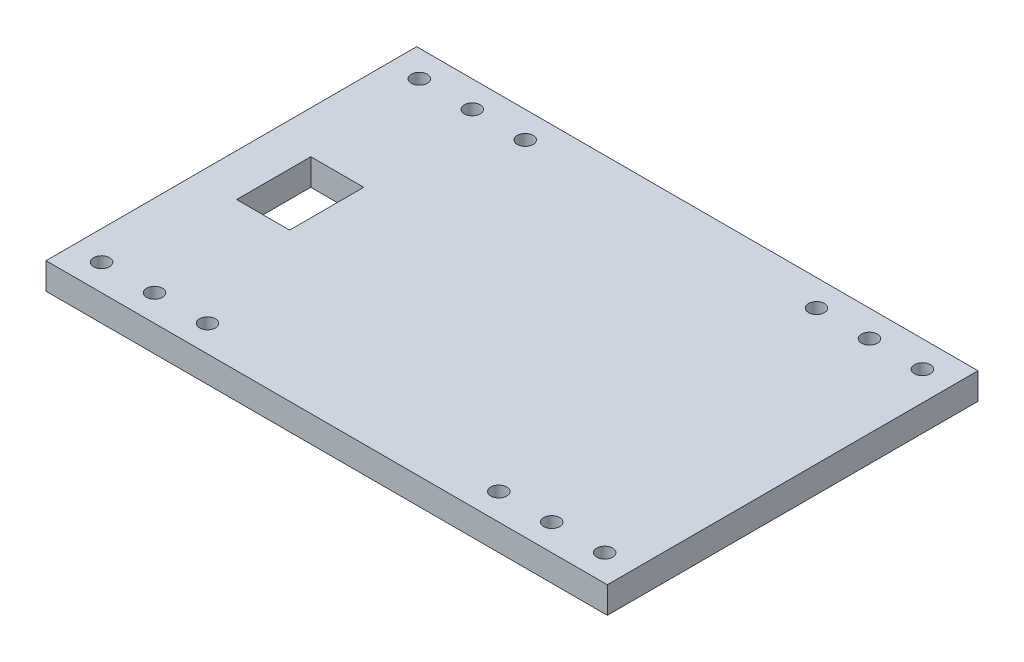
from build123d import *

# Parameters (mm, degrees)
SKETCH1_W               = 120
SKETCH1_H               = 70
BOSS_EXTRUDE1_DEPTH     = 5
CUT_EXTRUDE1_DEPTH      = 70.641941386
CUT_EXTRUDE1_DEPTH_BACK = 70.641941386
SKETCH2_W               = 10
SKETCH2_H               = 14
CUT_EXTRUDE2_DEPTH      = 70.641941386
CUT_EXTRUDE2_DEPTH_BACK = 70.641941386
SKETCH3_W               = 7
SKETCH3_H               = 70
CUT_EXTRUDE3_DEPTH      = 64.710281745
CUT_EXTRUDE3_DEPTH_BACK = 64.710281745
SKETCH4_R               = 1.5


with BuildPart() as part:
    # Sketch1 → Boss-Extrude1 (new body)
    with BuildSketch(Plane(origin=(0, 0, 0), x_dir=(1, 0, 0), z_dir=(0, 1, 0))):
        Rectangle(SKETCH1_W, SKETCH1_H)
    extrude(amount=BOSS_EXTRUDE1_DEPTH)

    # Sketch2 → Cut-Extrude1 (cut, two sides: drawn at the far end of the back side and taken through both)
    with BuildSketch(Plane(origin=(0, 5, 0), x_dir=(1, 0, 0), z_dir=(0, 1, 0)).offset(-CUT_EXTRUDE1_DEPTH_BACK)):
        with Locations((-40, 0)):
            Rectangle(SKETCH2_W, SKETCH2_H)
    extrude(amount=CUT_EXTRUDE1_DEPTH + CUT_EXTRUDE1_DEPTH_BACK, mode=Mode.SUBTRACT)

    # Sketch3 → Cut-Extrude2 (cut, two sides: drawn at the far end of the back side and taken through both)
    with BuildSketch(Plane(origin=(0, 5, 0), x_dir=(1, 0, 0), z_dir=(0, 1, 0)).offset(-CUT_EXTRUDE2_DEPTH_BACK)):
        with Locations((56.5, 0)):
            Rectangle(SKETCH3_W, SKETCH3_H)
        with Locations((-56.5, 0)):
            Rectangle(SKETCH3_W, SKETCH3_H)
    extrude(amount=CUT_EXTRUDE2_DEPTH + CUT_EXTRUDE2_DEPTH_BACK, mode=Mode.SUBTRACT)

    # Sketch4 → Cut-Extrude3 (cut, two sides: drawn at the far end of the back side and taken through both)
    with BuildSketch(Plane(origin=(0, 5, 0), x_dir=(1, 0, 0), z_dir=(0, 1, 0)).offset(-CUT_EXTRUDE3_DEPTH_BACK)):
        with Locations(Location((-37.5, -30, 0), (0, 0, 270))):
            Circle(SKETCH4_R)
        with Locations(Location((-27.5, -30, 0), (0, 0, 270))):
            Circle(SKETCH4_R)
        with Locations(Location((-47.5, -30, 0), (0, 0, 270))):
            Circle(SKETCH4_R)
        with Locations(Location((27.5, -30, 0), (0, 0, 90))):
            Circle(SKETCH4_R)
        with Locations(Location((47.5, -30, 0), (0, 0, 90))):
            Circle(SKETCH4_R)
        with Locations(Location((37.5, -30, 0), (0, 0, 90))):
            Circle(SKETCH4_R)
        with Locations(Location((47.5, 30, 0), (0, 0, 270))):
            Circle(SKETCH4_R)
        with Locations(Location((37.5, 30, 0), (0, 0, 270))):
            Circle(SKETCH4_R)
        with Locations(Location((27.5, 30, 0), (0, 0, 270))):
            Circle(SKETCH4_R)
        with Locations(Location((-27.5, 30, 0), (0, 0, 90))):
            Circle(SKETCH4_R)
        with Locations(Location((-37.5, 30, 0), (0, 0, 90))):
            Circle(SKETCH4_R)
        with Locations(Location((-47.5, 30, 0), (0, 0, 90))):
            Circle(SKETCH4_R)
    extrude(amount=CUT_EXTRUDE3_DEPTH + CUT_EXTRUDE3_DEPTH_BACK, mode=Mode.SUBTRACT)


solid = part.part
